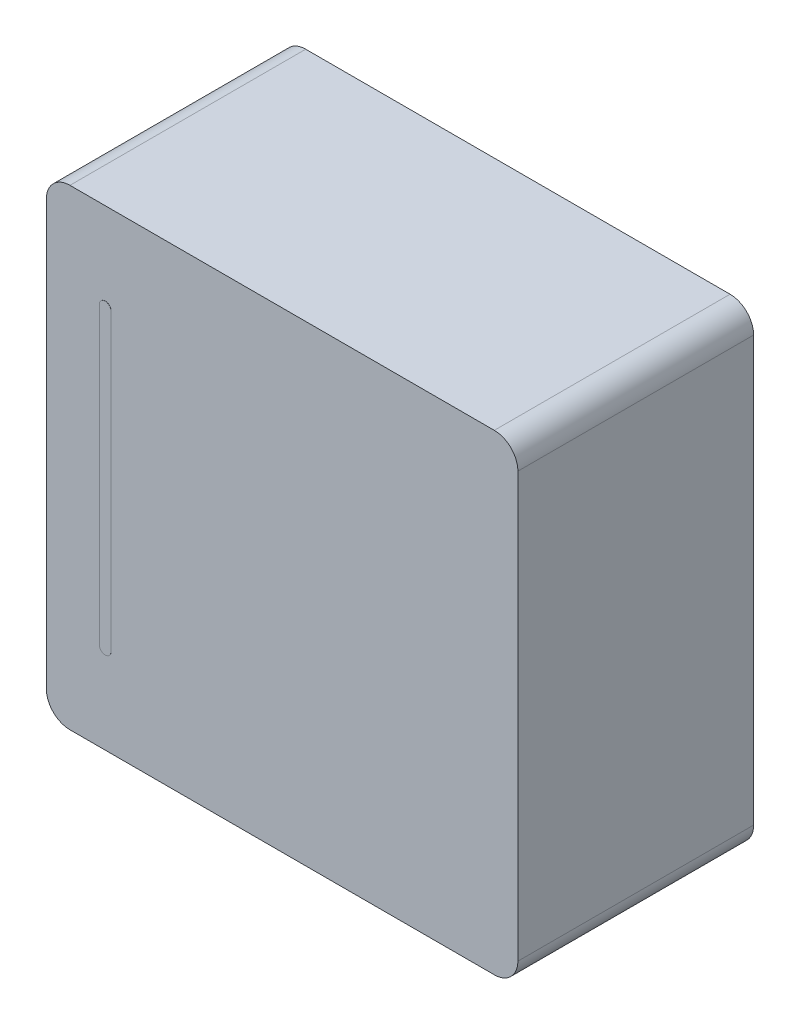
from build123d import *

# Parameters (mm, degrees)
ESQUISSE2_W  = 0.98
ESQUISSE2_H  = 3.4
PADS_DEPTH   = 0.1
PADS_2_DEPTH = 0.1
BODY_DEPTH   = 2
MARK_DEPTH   = 0.001


with BuildPart() as part:
    # Esquisse2 → pads (new body)
    with BuildSketch(Plane.XY):
        with Locations((-1.185, 0)):
            Rectangle(ESQUISSE2_W, ESQUISSE2_H)
    extrude(amount=PADS_DEPTH)



with BuildPart() as body_2:
    # Esquisse2 → pads 2 (new body)
    with BuildSketch(Plane.XY):
        with Locations((1.185, 0)):
            Rectangle(ESQUISSE2_W, ESQUISSE2_H)
    extrude(amount=PADS_2_DEPTH)


with BuildPart() as part_1:
    add(part.part)

    add(body_2.part)  # body merges body 2
    # Esquisse1 → body (add)
    with BuildSketch(Plane.XY.offset(0.1)):
        with BuildLine():
            Line((-1.8, 2), (1.8, 2))
            ThreePointArc((1.8, 2), (1.941421356, 1.941421356), (2, 1.8))
            Line((2, 1.8), (2, -1.8))
            ThreePointArc((2, -1.8), (1.941421356, -1.941421356), (1.8, -2))
            Line((1.8, -2), (-1.8, -2))
            ThreePointArc((-1.8, -2), (-1.941421356, -1.941421356), (-2, -1.8))
            Line((-2, -1.8), (-2, 1.8))
            ThreePointArc((-2, 1.8), (-1.941421356, 1.941421356), (-1.8, 2))
        make_face()
    extrude(amount=BODY_DEPTH)

    # Esquisse3 → mark (add)
    with BuildSketch(Plane.XY.offset(2.1)):
        with BuildLine():
            Line((-1.55, -1.25), (-1.55, 1.25))
            ThreePointArc((-1.55, 1.25), (-1.5, 1.3), (-1.45, 1.25))
            Line((-1.45, 1.25), (-1.45, -1.25))
            ThreePointArc((-1.45, -1.25), (-1.5, -1.3), (-1.55, -1.25))
        make_face()
    extrude(amount=MARK_DEPTH)


solid = part_1.part
